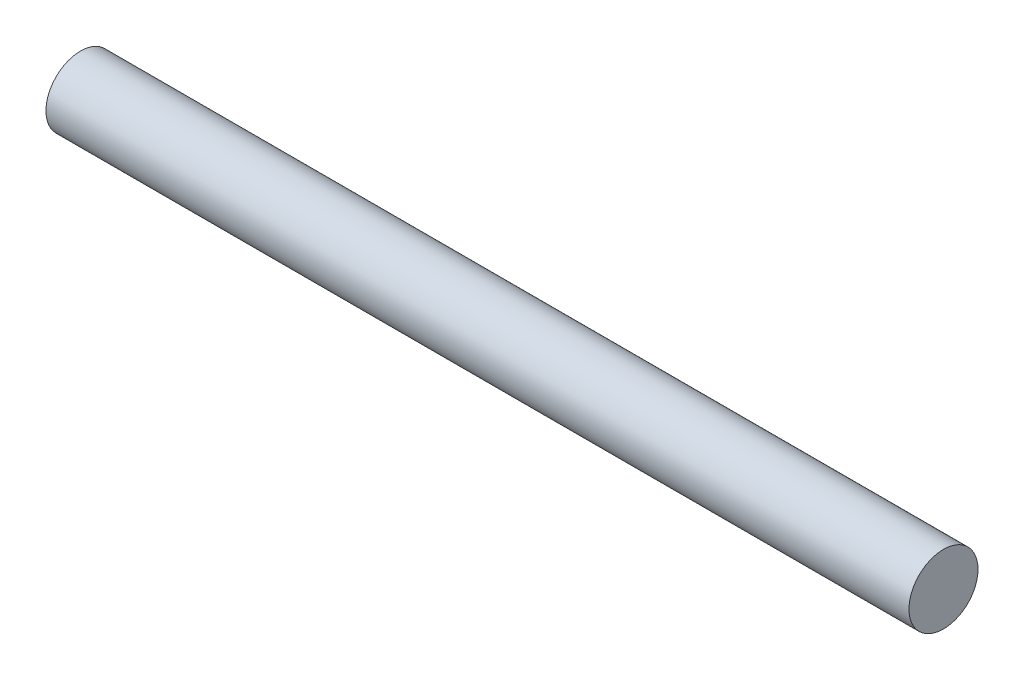
from build123d import *

# Parameters (mm, degrees)
SKETCH_1_R      = 4
EXTRUDE_1_DEPTH = 100


with BuildPart() as part:
    # Эскиз1 → Вытянуть1 (new body)
    with BuildSketch(Plane(origin=(0, 0, 0), x_dir=(0, 0, -1), z_dir=(1, 0, 0))):
        Circle(SKETCH_1_R)
    extrude(amount=EXTRUDE_1_DEPTH)


solid = part.part
